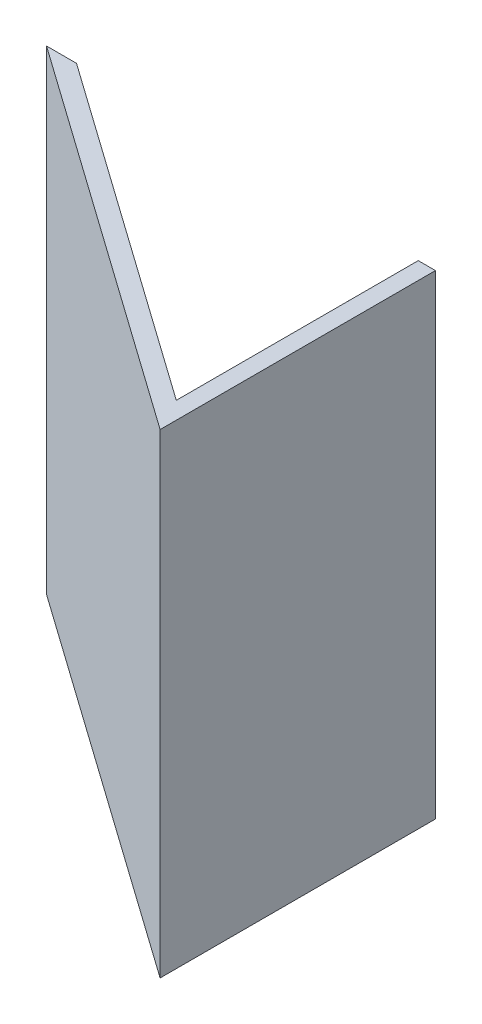
from build123d import *

# Parameters (mm, degrees)
BOSS_EXTRUDE1_DEPTH = 87.63


with BuildPart() as part:
    # Sketch1 → Boss-Extrude1 (new body)
    with BuildSketch(Plane(origin=(0, 0, 0), x_dir=(1, 0, 0), z_dir=(0, 1, 0))):
        Polygon((65.027116768, 34.190845126), (65.027116768, -16.609154874), (-6.727883232, 34.190845126), (-1.200843232, 34.190845126), (61.852116768, -10.449654874), (61.852116768, 34.190845126), align=None)
    extrude(amount=BOSS_EXTRUDE1_DEPTH)


solid = part.part
